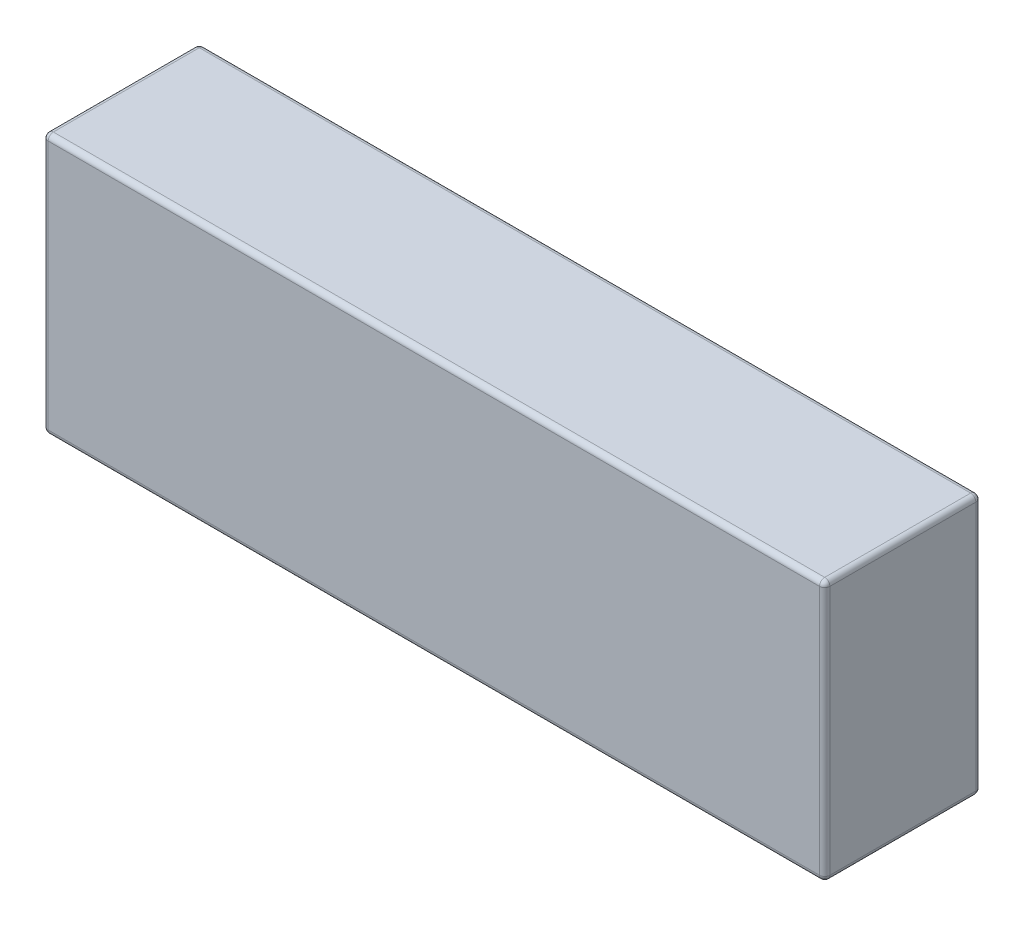
from build123d import *

# Parameters (mm, degrees)
SKETCH1_W           = 150
SKETCH1_H           = 50
BOSS_EXTRUDE1_DEPTH = 28
SKETCH3_W           = 150
SKETCH3_H           = 50
BOSS_EXTRUDE2_DEPTH = 1
SKETCH4_W           = 150
SKETCH4_H           = 50
BOSS_EXTRUDE3_DEPTH = 1
FILLET1_R           = 1


with BuildPart() as part:
    # Sketch1 → Boss-Extrude1 (new body)
    with BuildSketch(Plane.XY):
        Rectangle(SKETCH1_W, SKETCH1_H)
    extrude(amount=BOSS_EXTRUDE1_DEPTH)

    # Sketch3 → Boss-Extrude2 (add)
    with BuildSketch(Plane.XY.offset(28)):
        Rectangle(SKETCH3_W, SKETCH3_H)
    extrude(amount=BOSS_EXTRUDE2_DEPTH)

    # Sketch4 → Boss-Extrude3 (add)
    with BuildSketch(Plane(origin=(0, 0, 0), x_dir=(-1, 0, 0), z_dir=(0, 0, -1))):
        Rectangle(SKETCH4_W, SKETCH4_H)
    extrude(amount=BOSS_EXTRUDE3_DEPTH)

    # Fillet1
    fillet1_edges = [part.edges().sort_by_distance(p)[0] for p in [
        (75, 0, 29),
        (0, 25, 29),
        (-75, 0, 29),
        (0, -25, 29),
        (-75, 0, -1),
        (0, 25, -1),
        (75, 0, -1),
        (0, -25, -1),
        (75, -25, 14),
        (-75, -25, 14),
        (-75, 25, 14),
        (75, 25, 14),
    ]]
    fillet(fillet1_edges, radius=FILLET1_R)


solid = part.part
